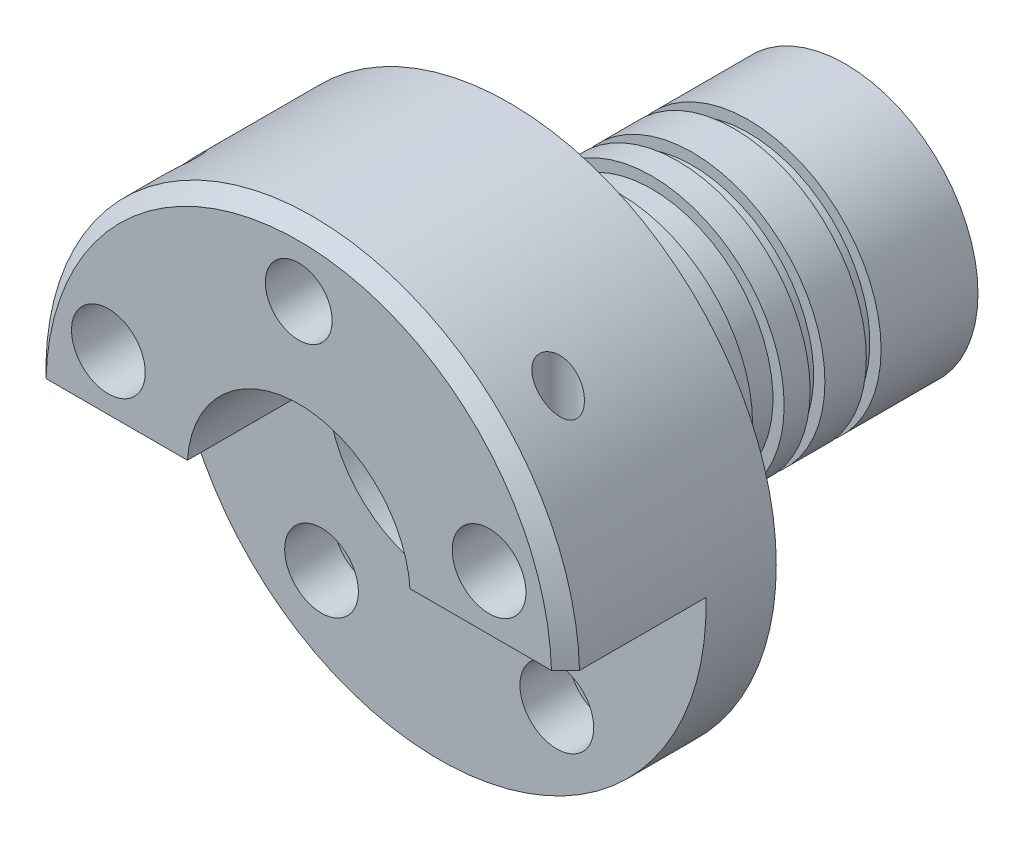
from build123d import *

# Parameters (mm, degrees)
SKETCH1_R           = 18.875
SKETCH1_R_2         = 15.875
BOSS_EXTRUDE1_DEPTH = 47.85
SKETCH2_R           = 38
BOSS_EXTRUDE2_DEPTH = 30
SKETCH3_R           = 15.875
CUT_EXTRUDE1_DEPTH  = 47.85
SKETCH4_W           = 76
SKETCH4_H           = 20
CUT_EXTRUDE2_DEPTH  = 47.85
SKETCH5_R           = 2.65
CUT_EXTRUDE3_DEPTH  = 47.85
SKETCH11_R          = 1
CUT_EXTRUDE4_DEPTH  = 30
SKETCH12_R          = 4.7625
CUT_EXTRUDE5_DEPTH  = 8
SKETCH13_W          = 2.1
SKETCH13_H          = 3.2
SKETCH13_W_2        = 4.5
SKETCH13_H_2        = 2.2
SKETCH18_R          = 3.125
CUT_EXTRUDE8_DEPTH  = 30
SKETCH19_R          = 5.25
CUT_EXTRUDE9_DEPTH  = 27
SKETCH27_R          = 6.225
CUT_EXTRUDE12_DEPTH = 1.6
CHAMFER1_SIZE       = 2
SKETCH28_W          = 76
SKETCH28_H          = 20
CUT_EXTRUDE13_DEPTH = 1


with BuildPart() as part:
    # Sketch1 → Boss-Extrude1 (new body)
    with BuildSketch(Plane.XY):
        Circle(SKETCH1_R)
        Circle(SKETCH1_R_2, mode=Mode.SUBTRACT)
    extrude(amount=BOSS_EXTRUDE1_DEPTH)

    # Sketch2 → Boss-Extrude2 (add)
    with BuildSketch(Plane.XY.offset(47.85)):
        Circle(SKETCH2_R)
    extrude(amount=BOSS_EXTRUDE2_DEPTH)

    # Sketch3 → Cut-Extrude1 (cut)
    with BuildSketch(Plane(origin=(0, 0, 47.85), x_dir=(-1, 0, 0), z_dir=(0, 0, -1))):
        with Locations(Location((0, 0, 0), (0, 0, 180))):
            Circle(SKETCH3_R)
    extrude(amount=-CUT_EXTRUDE1_DEPTH, mode=Mode.SUBTRACT)

    # Sketch4 → Cut-Extrude2 (cut)
    with BuildSketch(Plane(origin=(0, 0, 0), x_dir=(1, 0, 0), z_dir=(0, 1, 0))):
        with Locations((0, -67.85)):
            Rectangle(SKETCH4_W, SKETCH4_H)
    extrude(amount=-CUT_EXTRUDE2_DEPTH, mode=Mode.SUBTRACT)

    # Sketch5 → Cut-Extrude3 (cut)
    with BuildSketch(Plane(origin=(0, 0, 0), x_dir=(-1, 0, 0), z_dir=(0, -1, 0))):
        with Locations(Location((26.9375, -67.85, 0), (0, 0, 90))):
            Circle(SKETCH5_R)
        with Locations(Location((-26.9375, -67.85, 0), (0, 0, 90))):
            Circle(SKETCH5_R)
    extrude(amount=-CUT_EXTRUDE3_DEPTH, mode=Mode.SUBTRACT)

    # Sketch11 → Cut-Extrude4 (cut)
    with BuildSketch(Plane.XY.offset(77.85)):
        with Locations((0, 28.5)):
            Circle(SKETCH11_R)
    extrude(amount=-CUT_EXTRUDE4_DEPTH, mode=Mode.SUBTRACT)

    # Sketch12 → Cut-Extrude5 (cut)
    with BuildSketch(Plane.XY.offset(77.85)):
        with Locations((0, 28.5)):
            Circle(SKETCH12_R)
    extrude(amount=-CUT_EXTRUDE5_DEPTH, mode=Mode.SUBTRACT)

    # Sketch13 → Cut-Revolve1 (revolve, cut)
    with BuildSketch(Plane(origin=(0, 0, 0), x_dir=(0, 0, -1), z_dir=(1, 0, 0)), mode=Mode.PRIVATE) as cut_revolve1_sk:
        with Locations((-14.85, 18.875)):
            Rectangle(SKETCH13_W, SKETCH13_H)
        with Locations((-22.85, 18.875)):
            Rectangle(SKETCH13_W, SKETCH13_H)
        with Locations((-35.85, 18.875)):
            Rectangle(SKETCH13_W, SKETCH13_H)
        with Locations((-39.85, 18.875)):
            Rectangle(SKETCH13_W, SKETCH13_H)
        with Locations((-29.85, 18.375)):
            Rectangle(SKETCH13_W_2, SKETCH13_H_2)
    revolve(cut_revolve1_sk.sketch.rotate(Axis((0, 0, 0), (0, 0, 1)), 90), axis=Axis((0, 0, 0), (0, 0, 1)), mode=Mode.SUBTRACT)

    # Sketch18 → Cut-Extrude8 (cut)
    with BuildSketch(Plane.XY.offset(77.85)):
        with Locations((27.105110714, 8.80698434)):
            Circle(SKETCH18_R)
        with Locations((16.75187969, -23.05698434)):
            Circle(SKETCH18_R)
        with Locations((-16.75187969, -23.05698434)):
            Circle(SKETCH18_R)
        with Locations((-27.105110714, 8.80698434)):
            Circle(SKETCH18_R)
    extrude(amount=-CUT_EXTRUDE8_DEPTH, mode=Mode.SUBTRACT)

    # Sketch19 → Cut-Extrude9 (cut)
    with BuildSketch(Plane.XY.offset(77.85)):
        with Locations((27.105110714, 8.80698434)):
            Circle(SKETCH19_R)
        with Locations((16.75187969, -23.05698434)):
            Circle(SKETCH19_R)
        with Locations((-16.75187969, -23.05698434)):
            Circle(SKETCH19_R)
        with Locations((-27.105110714, 8.80698434)):
            Circle(SKETCH19_R)
    extrude(amount=-CUT_EXTRUDE9_DEPTH, mode=Mode.SUBTRACT)

    # Sketch27 → Cut-Extrude12 (cut)
    with BuildSketch(Plane(origin=(0, 0, 47.85), x_dir=(-1, 0, 0), z_dir=(0, 0, -1))):
        with Locations((0, 28.5)):
            Circle(SKETCH27_R)
    extrude(amount=-CUT_EXTRUDE12_DEPTH, mode=Mode.SUBTRACT)

    # Chamfer1
    chamfer1_edges = [part.edges().sort_by_distance(p)[0] for p in [
        (0, 38, 77.85),
    ]]
    chamfer(chamfer1_edges, length=CHAMFER1_SIZE)

    # Sketch28 → Cut-Extrude13 (cut)
    with BuildSketch(Plane(origin=(0, 0, 0), x_dir=(-1, 0, 0), z_dir=(0, -1, 0))):
        with Locations((0, -67.85)):
            Rectangle(SKETCH28_W, SKETCH28_H)
    extrude(amount=-CUT_EXTRUDE13_DEPTH, mode=Mode.SUBTRACT)


solid = part.part
